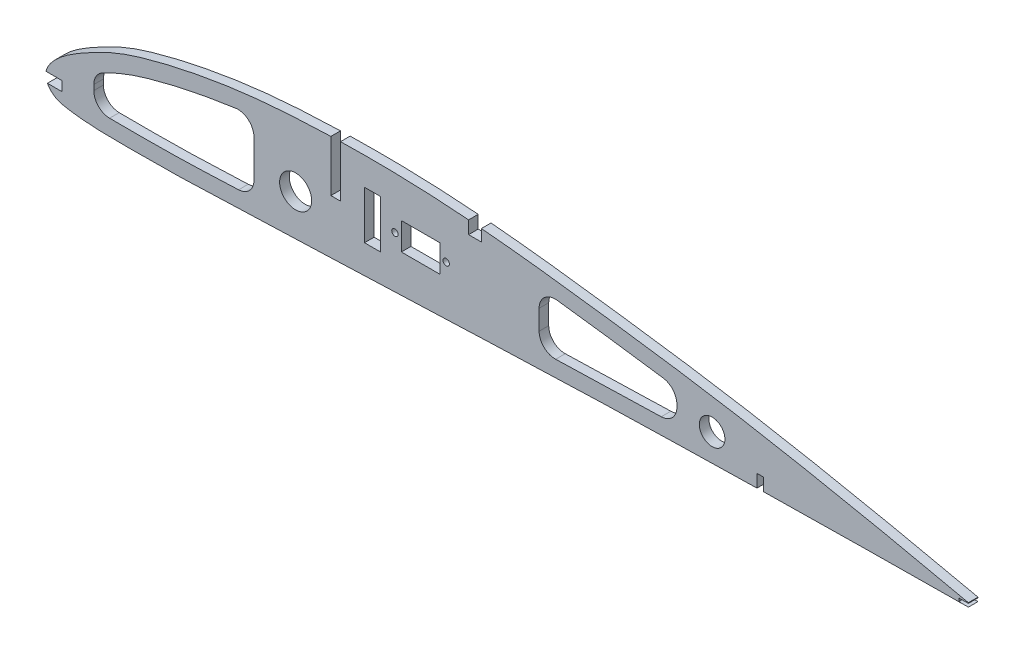
from build123d import *

# Parameters (mm, degrees)
SKETCH_1_R          = 5
SKETCH_1_R_2        = 4
EXTRUDE_1_DEPTH     = 3
SKETCH_3_W          = 5
SKETCH_3_H          = 15
SKETCH_3_W_2        = 12
SKETCH_3_H_2        = 8.5
SKETCH_3_R          = 1
SKETCH_3_W_3        = 4
SKETCH_3_H_3        = 4
CUT_EXTRUDE_2_DEPTH = 291.422386836


with BuildPart() as part:
    # 草图1 → 凸台-拉伸1 (new body)
    with BuildSketch(Plane.XY):
        with BuildLine():
            Line((90, 12.3715), (90, 28.372426217))
            add(Edge.make_bspline(
                [(90, 28.372426217), (89.259446982, 28.350928743), (82.363996343, 28.13322439), (72.403347361, 27.586524792), (60.185862052, 26.226268085), (51.080991088, 24.79810862), (42.033943524, 23.000087944), (34.581994337, 21.174922903), (28.697351661, 19.44563851), (24.361981086, 17.983441115), (20.174828998, 16.207949367), (16.078941989, 14.139912989), (12.040296713, 11.946766626), (8.14011433, 9.56039573), (5.153679337, 7.316395724), (3.100060439, 5.200618052), (1.813825976, 3.470730924), (1.237398467, 2.180506339), (1.085380705, 1.529058937), (1.078882286, 1.5)],
                knots=[0.345773533, 0.345773533, 0.345773533, 0.345773533, 0.349398211, 0.379527288, 0.394591827, 0.409656366, 0.424720905, 0.439785444, 0.447317713, 0.454849983, 0.462382252, 0.469914522, 0.477446791, 0.484979061, 0.49251133, 0.496277465, 0.5000436, 0.503809734, 0.503985678, 0.503985678, 0.503985678, 0.503985678], degree=3))
            Line((1.078882286, 1.5), (6, 1.5))
            Line((6, 1.5), (6, -1.5))
            Line((6, -1.5), (1.522379628, -1.5))
            add(Edge.make_bspline(
                [(1.522379628, -1.5), (1.617903461, -1.678770523), (2.068186491, -2.42442122), (3.143139608, -3.601090845), (4.854253, -4.619355756), (6.927567017, -5.105597911), (9.209034621, -5.454839075), (12.219971865, -5.84289763), (16.020132359, -6.14266222), (20.609524976, -6.2611368), (25.231457517, -6.286948592), (31.397380169, -6.280305851), (39.107274969, -6.240736398), (48.336813051, -6.022096429), (57.579935967, -5.612990736), (66.840654471, -5.242934226), (76.096556555, -4.921715721), (88.435998513, -4.515955408), (103.853120896, -3.973102953), (122.354625015, -3.248110744), (140.857835973, -2.495489966), (159.368527813, -1.804089638), (177.884173919, -1.222493213), (196.4033921, -0.774877257), (211.439290174, -0.454334834), (220.305576898, -0.265987383), (223, -0.210849605)],
                knots=[0.510182255, 0.510182255, 0.510182255, 0.510182255, 0.511342004, 0.515108139, 0.518874273, 0.522640408, 0.526406543, 0.530172677, 0.537704947, 0.545237216, 0.552769486, 0.560301755, 0.575366294, 0.590430833, 0.605495372, 0.620559911, 0.63562445, 0.650688989, 0.680818067, 0.710947144, 0.741076222, 0.7712053, 0.801334378, 0.831463456, 0.861592533, 0.874744372, 0.874744372, 0.874744372, 0.874744372], degree=3))
            Line((223, -0.210849605), (223, 3.788737263))
            Line((223, 3.788737263), (225, 3.788737263))
            Line((225, 3.788737263), (225, -0.170338801))
            add(Edge.make_bspline(
                [(225, -0.170338801), (227.811595191, -0.114017747), (236.796798206, 0.056910764), (251.961175933, 0.256656825), (270.471854229, 0.429163033), (282.824771355, 0.587434741), (289, 0.610062865)],
                knots=[0.877998396, 0.877998396, 0.877998396, 0.877998396, 0.891721611, 0.921850689, 0.951979767, 0.982108845, 0.982108845, 0.982108845, 0.982108845], degree=3))
            Line((289, 0.610062865), (286, 0.610062865))
            Line((286, 0.610062865), (286, 1.610062865))
            Line((286, 1.610062865), (289, 1.610062865))
            Line((289, 1.610062865), (289, 1.816246039))
            add(Edge.make_bspline(
                [(289, 1.816246039), (276.957314444, 4.502285023), (258.861554155, 8.397620333), (234.648247971, 13.152786595), (216.448478593, 16.478914183), (198.182873559, 19.371550405), (179.850571346, 21.924148488), (161.503162682, 24.358614825), (143.127892269, 26.473190985), (124.712239059, 28.043780086), (107.994173705, 28.616385423), (97.416270032, 28.546670082), (93, 28.44913561)],
                knots=[0.017978355, 0.017978355, 0.017978355, 0.017978355, 0.07823651, 0.108365588, 0.138494666, 0.168623744, 0.198752821, 0.228881899, 0.259010977, 0.289140055, 0.319269133, 0.340879606, 0.340879606, 0.340879606, 0.340879606], degree=3))
            Line((93, 28.44913561), (93, 12.3715))
            Line((93, 12.3715), (90, 12.3715))
        make_face()
        with Locations((79, 8)):
            Circle(SKETCH_1_R, mode=Mode.SUBTRACT)
        with Locations((209, 8)):
            Circle(SKETCH_1_R_2, mode=Mode.SUBTRACT)
    extrude(amount=EXTRUDE_1_DEPTH)

    # 草图3 → 切除-拉伸2 (cut, through all)
    with BuildSketch(Plane.XY):
        with Locations((103, 12.3715)):
            Rectangle(SKETCH_3_W, SKETCH_3_H)
        with Locations((118, 12.3715)):
            Rectangle(SKETCH_3_W_2, SKETCH_3_H_2)
        with Locations(Location((110, 12.3715, 0), (0, 0, 180))):
            Circle(SKETCH_3_R)
        with Locations(Location((126, 12.3715, 0), (0, 0, 180))):
            Circle(SKETCH_3_R)
        with Locations((134.995432672, 25.302899085)):
            Rectangle(SKETCH_3_W_3, SKETCH_3_H_3)
        with BuildLine():
            add(Edge.make_bspline(
                [(193.718444833, 14.915410202), (192.779013077, 15.051811632), (191.839123333, 15.187073825), (186.824226186, 15.902901834), (182.740892869, 16.465870736), (174.565909682, 17.575800313), (170.481299177, 18.120965891), (164.469973656, 18.894543341), (162.541485429, 19.138417507), (160.613475955, 19.376775938)],
                knots=[0.485575284, 0.485575284, 0.485575284, 0.485575284, 0.5, 0.5, 0.5625, 0.5625, 0.625, 0.625, 0.654532252, 0.654532252, 0.654532252, 0.654532252], degree=3))
            ThreePointArc((160.613475955, 19.376775938), (156.688458046, 18.160710613), (155, 14.41455393))
            Line((155, 14.41455393), (155, 8.204846233))
            ThreePointArc((155, 8.204846233), (156.525241738, 4.609563904), (160.17042201, 3.207751443))
            add(Edge.make_bspline(
                [(160.17042201, 3.207751443), (162.389721662, 3.283438922), (164.609319497, 3.356780918), (171.504636491, 3.576232826), (176.18199895, 3.713351663), (184.945921303, 3.946800138), (189.03214497, 4.046860263), (193.116453453, 4.14201244)],
                knots=[0.720326449, 0.720326449, 0.720326449, 0.720326449, 0.75, 0.75, 0.8125, 0.8125, 0.867133534, 0.867133534, 0.867133534, 0.867133534], degree=3))
            ThreePointArc((193.116453453, 4.14201244), (196.576469437, 5.64653729), (198, 9.140656115))
            Line((198, 9.140656115), (198, 9.967295711))
            ThreePointArc((198, 9.967295711), (196.781019979, 13.238975389), (193.718444833, 14.915410202))
        make_face()
        with BuildLine():
            add(Edge.make_bspline(
                [(20.926673148, -1.249876658), (21.809693827, -1.262827876), (22.70041751, -1.270722289), (24.744752026, -1.282014543), (25.903390676, -1.283802206), (29.38108188, -1.283541675), (31.709604831, -1.277171959), (36.343989553, -1.248263334), (38.652190318, -1.223511787), (43.261210505, -1.138923387), (45.563329713, -1.080117385), (50.168153725, -0.92677743), (52.481550313, -0.831144642), (56.932408226, -0.642663317), (59.067384966, -0.552312083), (61.20153145, -0.466222597)],
                knots=[0.097228806, 0.097228806, 0.097228806, 0.097228806, 0.109375, 0.109375, 0.125, 0.125, 0.15625, 0.15625, 0.1875, 0.1875, 0.21875, 0.21875, 0.25, 0.25, 0.27850067, 0.27850067, 0.27850067, 0.27850067], degree=3))
            ThreePointArc((61.20153145, -0.466222597), (64.606082171, 1.066165303), (66, 4.529714259))
            Line((66, 4.529714259), (66, 16.175207171))
            ThreePointArc((66, 16.175207171), (64.287676463, 19.942325894), (60.32352661, 21.129234195))
            add(Edge.make_bspline(
                [(60.32352661, 21.129234195), (59.143282742, 20.968071656), (57.964431768, 20.796736398), (53.109249428, 20.046773379), (49.445857595, 19.384253181), (42.158673028, 17.868714577), (38.533379611, 17.019586343), (33.148990447, 15.546220745), (31.362942012, 15.022439399), (27.821005995, 13.880218625), (26.067238608, 13.253271835), (22.635818059, 11.812670552), (20.957942753, 11.004847704), (19.099592195, 10.049689097), (18.896441621, 9.944700093), (18.693547477, 9.839213217)],
                knots=[0.029920383, 0.029920383, 0.029920383, 0.029920383, 0.033494004, 0.033494004, 0.044658672, 0.044658672, 0.05582334, 0.05582334, 0.061405674, 0.061405674, 0.066988008, 0.066988008, 0.072570342, 0.072570342, 0.073256353, 0.073256353, 0.073256353, 0.073256353], degree=3))
            ThreePointArc((18.693547477, 9.839213217), (16.726110517, 7.997937304), (16, 5.402967421))
            Line((16, 5.402967421), (16, 3.749585631))
            ThreePointArc((16, 3.749585631), (17.438635496, 0.240072435), (20.926673148, -1.249876658))
        make_face()
    extrude(amount=CUT_EXTRUDE_2_DEPTH, mode=Mode.SUBTRACT)


solid = part.part
